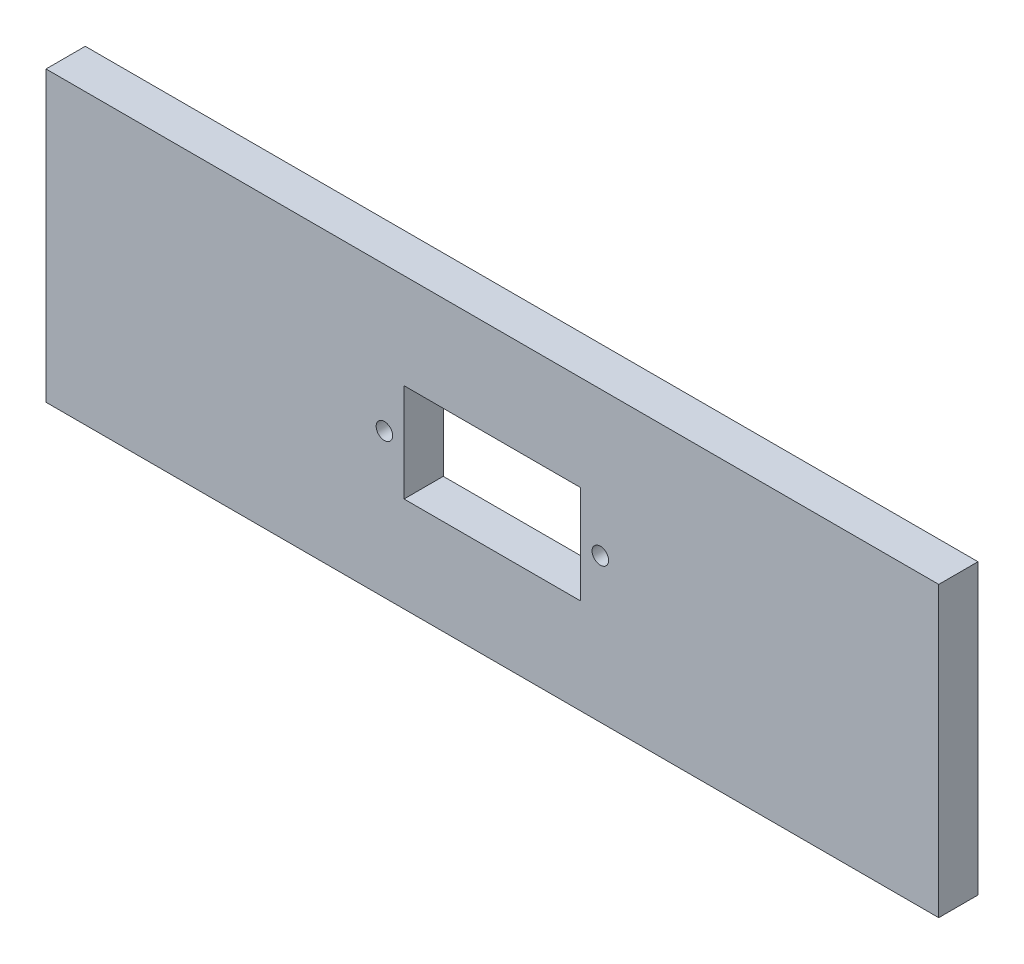
from build123d import *

# Parameters (mm, degrees)
SKETCH_1_W      = 113.688143332
SKETCH_1_H      = 36.761435568
SKETCH_1_R      = 1.05
SKETCH_1_W_2    = 22.5
SKETCH_1_H_2    = 12.5
EXTRUDE_1_DEPTH = 5


with BuildPart() as part:
    # ｽｹｯﾁ1 → ﾎﾞｽ - 押し出し1 (new body)
    with BuildSketch(Plane.XY):
        Rectangle(SKETCH_1_W, SKETCH_1_H)
        with Locations((-13.75, 0)):
            Circle(SKETCH_1_R, mode=Mode.SUBTRACT)
        with Locations((13.75, 0)):
            Circle(SKETCH_1_R, mode=Mode.SUBTRACT)
        Rectangle(SKETCH_1_W_2, SKETCH_1_H_2, mode=Mode.SUBTRACT)
    extrude(amount=EXTRUDE_1_DEPTH)


solid = part.part
